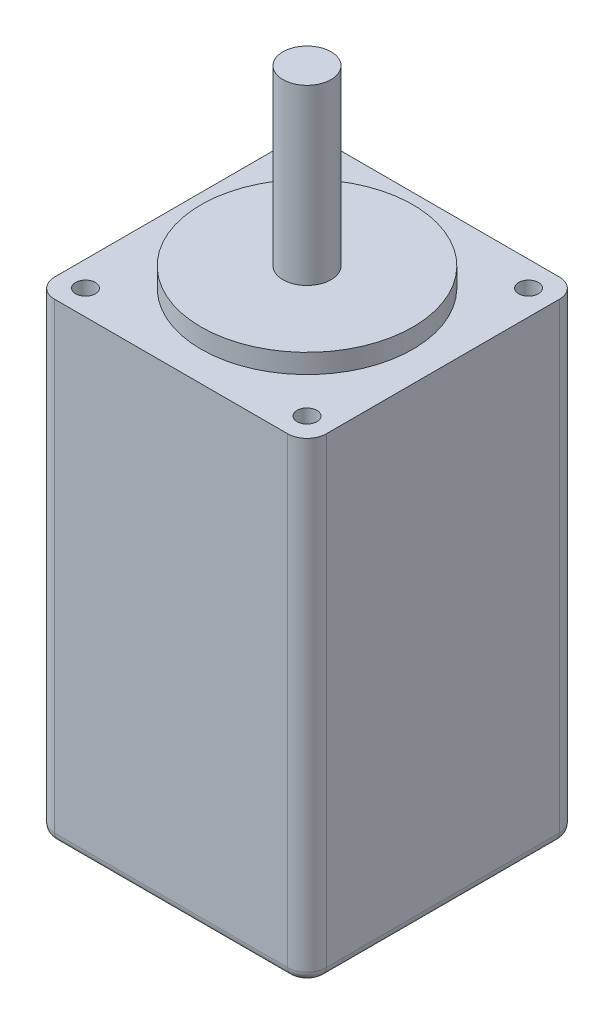
from build123d import *

# Parameters (mm, degrees)
SKETCH1_W                     = 28.2
SKETCH1_H                     = 28.2
BOSS_EXTRUDE1_DEPTH           = 49
SKETCH2_R                     = 11
BOSS_EXTRUDE2_DEPTH           = 2
SKETCH3_R                     = 2.5
BOSS_EXTRUDE3_DEPTH           = 18
FILLET1_R                     = 2
TAP_DRILL_FOR_M2_5_TAP1_D     = 2.05
TAP_DRILL_FOR_M2_5_TAP1_DEPTH = 4.5
TAP_DRILL_FOR_M2_5_TAP1_TIP   = 0.615882135
FILLET2_R                     = 1


with BuildPart() as part:
    # Sketch1 → Boss-Extrude1 (new body)
    with BuildSketch(Plane(origin=(0, 0, 0), x_dir=(1, 0, 0), z_dir=(0, 1, 0))):
        with Locations((14.1, 14.1)):
            Rectangle(SKETCH1_W, SKETCH1_H)
    extrude(amount=BOSS_EXTRUDE1_DEPTH)

    # Sketch2 → Boss-Extrude2 (add)
    with BuildSketch(Plane(origin=(0, 49, 0), x_dir=(1, 0, 0), z_dir=(0, 1, 0))):
        with Locations(Location((14.1, 14.1, 0), (0, 0, 270))):
            Circle(SKETCH2_R)
    extrude(amount=BOSS_EXTRUDE2_DEPTH)

    # Sketch3 → Boss-Extrude3 (add)
    with BuildSketch(Plane(origin=(0, 51, 0), x_dir=(1, 0, 0), z_dir=(0, 1, 0))):
        with Locations(Location((14.1, 14.1, 0), (0, 0, 270))):
            Circle(SKETCH3_R)
    extrude(amount=BOSS_EXTRUDE3_DEPTH)

    # Fillet1
    fillet1_edges = [part.edges().sort_by_distance(p)[0] for p in [
        (0, 24.5, -28.2),
        (28.2, 24.5, -28.2),
        (28.2, 24.5, 0),
        (0, 24.5, 0),
    ]]
    fillet(fillet1_edges, radius=FILLET1_R)

    # Tap Drill for M2.5 Tap1
    with Locations(Plane(origin=(0, 49, 0), x_dir=(1, 0, 0), z_dir=(0, 1, 0))):
        with Locations((2.6, 2.6), (25.6, 2.6), (25.6, 25.6), (2.6, 25.6)):
            Hole(TAP_DRILL_FOR_M2_5_TAP1_D / 2, depth=TAP_DRILL_FOR_M2_5_TAP1_DEPTH)
            with Locations((0, 0, -(TAP_DRILL_FOR_M2_5_TAP1_DEPTH + TAP_DRILL_FOR_M2_5_TAP1_TIP / 2))):  # 118° drill point
                Cone(0, TAP_DRILL_FOR_M2_5_TAP1_D / 2, TAP_DRILL_FOR_M2_5_TAP1_TIP, mode=Mode.SUBTRACT)

    # Fillet2
    fillet2_edges = [part.edges().sort_by_distance(p)[0] for p in [
        (14.1, 0, -28.2),
        (0, 0, -14.1),
        (28.2, 0, -14.1),
        (14.1, 0, 0),
        (0.585786438, 0, -0.585786438),
        (27.614213562, 0, -0.585786438),
        (0.585786438, 0, -27.614213562),
        (27.614213562, 0, -27.614213562),
    ]]
    fillet(fillet2_edges, radius=FILLET2_R)


solid = part.part
